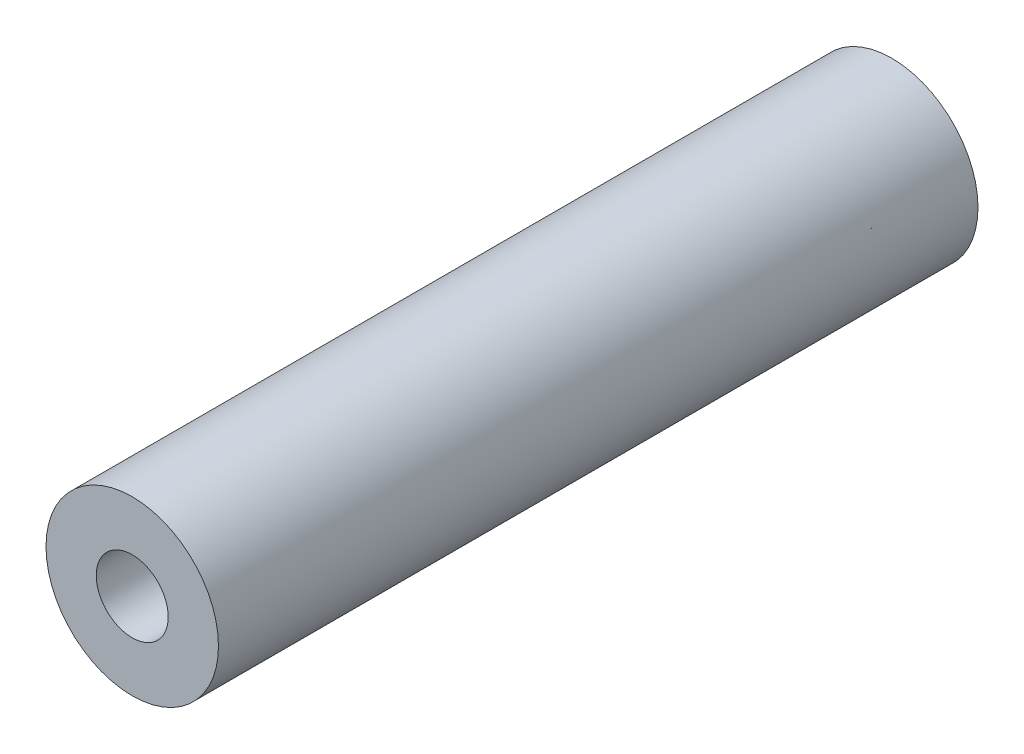
from build123d import *

# Parameters (mm, degrees)
SKETCH1_R           = 9.525
SKETCH1_R_2         = 3.9751
BOSS_EXTRUDE1_DEPTH = 83.896200465


with BuildPart() as part:
    # Sketch1 → Boss-Extrude1 (new body)
    with BuildSketch(Plane.XY):
        Circle(SKETCH1_R)
        Circle(SKETCH1_R_2, mode=Mode.SUBTRACT)
    extrude(amount=-BOSS_EXTRUDE1_DEPTH)


solid = part.part
